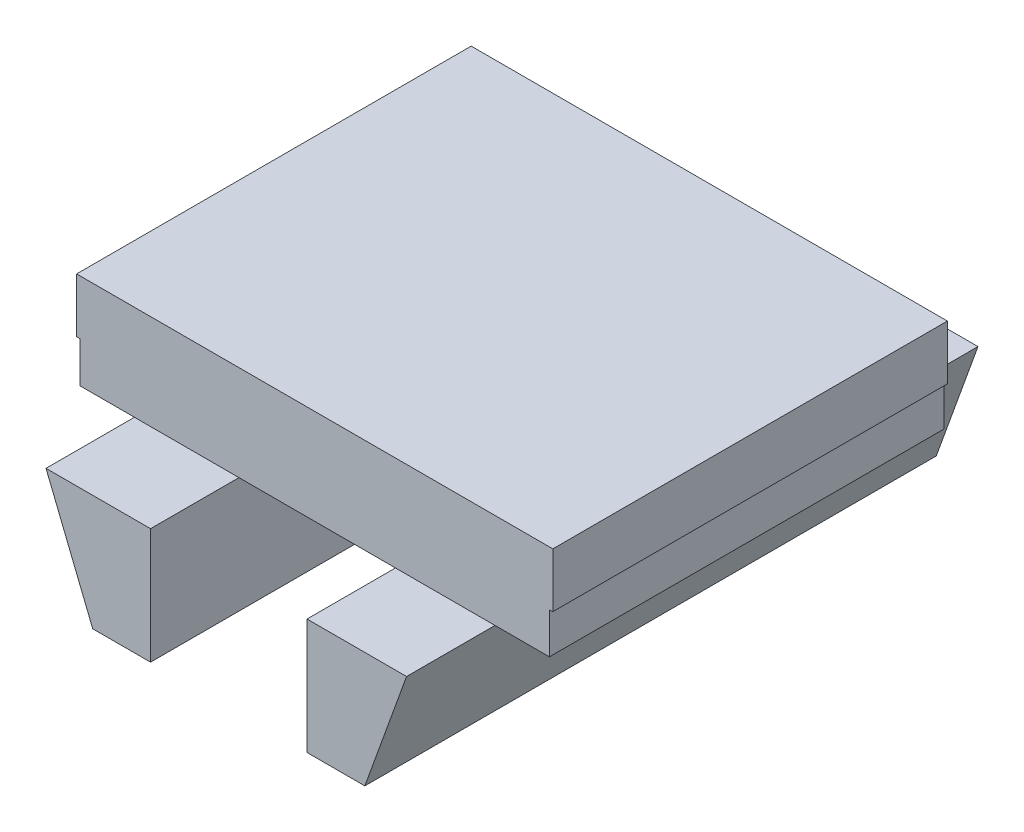
from build123d import *

# Parameters (mm, degrees)
SKETCH_1_W           = 70
SKETCH_1_H           = 8
EXTRUDE_1_DEPTH      = 58
SKETCH_2_W           = 69
SKETCH_2_H           = 58
EXTRUDE_2_DEPTH      = 6
EXTRUDE_3_DEPTH      = 71
EXTRUDE_3_DEPTH_BACK = 13
CUT_EXTRUDE_2_REACH  = 103.107
SKETCH_6_W           = 23
SKETCH_6_H           = 16.995926687


with BuildPart() as part:
    # 草图1 → 凸台-拉伸1 (new body)
    with BuildSketch(Plane.XY):
        with Locations((16.857142857, 5.142857143)):
            Rectangle(SKETCH_1_W, SKETCH_1_H)
    extrude(amount=EXTRUDE_1_DEPTH)

    # 草图2 → 凸台-拉伸2 (add)
    with BuildSketch(Plane.XZ.offset(-1.142857143)):
        with Locations((16.857142857, 29)):
            Rectangle(SKETCH_2_W, SKETCH_2_H)
    extrude(amount=EXTRUDE_2_DEPTH)

    # 草图4 → 凸台-拉伸3 (add, two sides: drawn at the far end of the back side and taken through both)
    with BuildSketch(Plane.XY.offset(-EXTRUDE_3_DEPTH_BACK)):
        Polygon((-9.642857143, -4.857142857), (43.357142857, -4.857142857), (37.223942971, -21.853069544), (-2.776057029, -21.853069544), align=None)
    extrude(amount=EXTRUDE_3_DEPTH + EXTRUDE_3_DEPTH_BACK)

    # 草图6 → 切除-拉伸2 (cut, up to next)
    with BuildSketch(Plane.XY.offset(71), mode=Mode.PRIVATE) as cut_extrude_2_sk1:
        with Locations((17.223942971, -13.3551062)):
            Rectangle(SKETCH_6_W, SKETCH_6_H)
    cut_extrude_2_tool1 = extrude(cut_extrude_2_sk1.sketch, amount=-CUT_EXTRUDE_2_REACH, mode=Mode.PRIVATE) & part.part
    add(cut_extrude_2_tool1.solids().sort_by_distance((17.223943, -13.355106, 71))[0], mode=Mode.SUBTRACT)


solid = part.part
